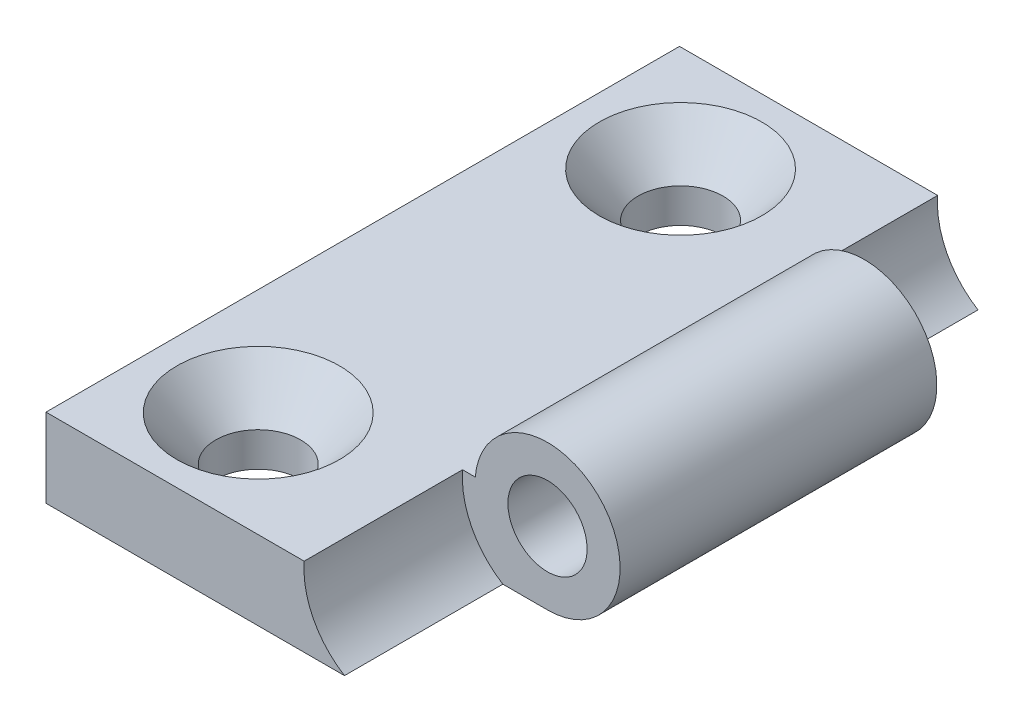
from build123d import *

# Parameters (mm, degrees)
SKETCH1_R                                    = 2.38125
EXTRUDE1_DEPTH                               = 19.05
CUT_EXTRUDE1_DEPTH                           = 9.525
CSK_FOR_10_FLAT_HEAD_MACHINE_SCREW1_AT_COUNT = 2
CSK_FOR_10_FLAT_HEAD_MACHINE_SCREW1_AT_PITCH = 25.4


with BuildPart() as part:
    # Sketch1 → Extrude1 (new, symmetric)
    with BuildSketch(Plane.XY):
        with BuildLine():
            Line((-20.6375, 0), (0, 0))
            ThreePointArc((0, 0), (3.219925902, 1.417615701), (4.348688447, 4.7498))
            ThreePointArc((4.348688447, 4.7498), (0, 8.73125), (-4.348688447, 4.7498))
            Line((-4.348688447, 4.7498), (-20.6375, 4.7498))
            Line((-20.6375, 4.7498), (-20.6375, 0))
        make_face()
        with Locations(Location((0, 4.365625, 0), (0, 0, 180))):
            Circle(SKETCH1_R, mode=Mode.SUBTRACT)
    extrude(amount=EXTRUDE1_DEPTH, both=True)

    # Sketch2 → Cut-Extrude1 (cut)
    with BuildSketch(Plane.XY.offset(19.05)):
        with BuildLine():
            Line((-5.110688447, 4.7498), (-4.348688447, 4.7498))
            ThreePointArc((-4.348688447, 4.7498), (3.936533663, 7.969725902), (0, 0))
            Line((0, 0), (-2.684780288, 0))
            ThreePointArc((-2.684780288, 0), (-4.564261518, 2.034478581), (-5.110688447, 4.7498))
        make_face()
    cut_extrude1 = extrude(amount=-CUT_EXTRUDE1_DEPTH, mode=Mode.SUBTRACT)

    # Mirror1: Cut-Extrude1 across plane
    add(cut_extrude1.mirror(Plane.XY), mode=Mode.SUBTRACT)

    # Sketch6 → CSK for #10 Flat Head Machine Screw1 (revolve, cut)
    with BuildSketch(Plane(origin=(-14.224, 4.7498, -12.7), x_dir=(0, 0, 1), z_dir=(1, 0, 0))):
        Polygon((0, 0), (0, 4.7498), (2.5527, 4.7498), (2.5527, 2.688180894), (4.8895, 0), align=None)
    csk_for_10_flat_head_machine_screw1 = revolve(axis=Axis((-14.224, 11.0998, -12.7), (0, -1, 0)), mode=Mode.SUBTRACT)

    # CSK for #10 Flat Head Machine Screw1 at: CSK for #10 Flat Head Machine Screw1 ×2
    with Locations(*[(0, 0, i * CSK_FOR_10_FLAT_HEAD_MACHINE_SCREW1_AT_PITCH) for i in range(1, CSK_FOR_10_FLAT_HEAD_MACHINE_SCREW1_AT_COUNT)]):
        add(csk_for_10_flat_head_machine_screw1, mode=Mode.SUBTRACT)


solid = part.part
